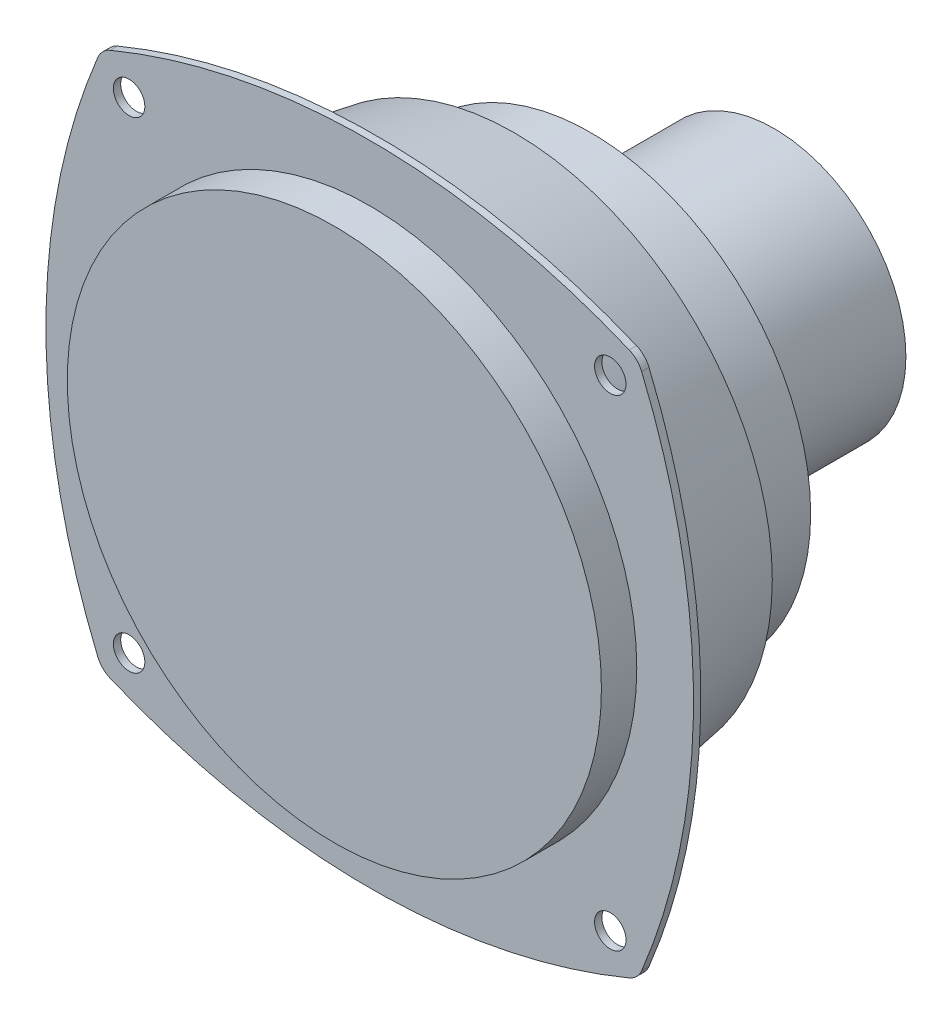
from build123d import *

# Parameters (mm, degrees)
BOSS_EXTRUDE1_DEPTH        = 1
F_4_3_4_3_DIAMETER_HOLE1_D = 4.3
SKETCH6_W                  = 28.17
SKETCH6_H                  = 2.5
BOSS_EXTRUDE2_DEPTH        = 23.53


with BuildPart() as part:
    # Sketch1 → Revolve1 (revolve)
    with BuildSketch(Plane(origin=(0, 0, 0), x_dir=(0, 0, -1), z_dir=(1, 0, 0)), mode=Mode.PRIVATE) as revolve1_sk:
        Polygon((60.11, 0), (60.11, 18), (35.01, 18), (35.01, 30.085), (24.6, 30.085), (24.6, 35.25), (5.83, 38.44), (5.83, 44.25), (4.83, 44.25), (4.83, 36.5), (0, 36.5), (0, 0), align=None)
    revolve(revolve1_sk.sketch.rotate(Axis((0, 0, 0), (0, 0, -1)), 90), axis=Axis((0, 0, 0), (0, 0, -1)))

    # Sketch2 → Boss-Extrude1 (add)
    with BuildSketch(Plane.XY.offset(-4.83)):
        with BuildLine():
            ThreePointArc((-35.456787888, 37.168658693), (0, 44.25), (35.456787888, 37.168658693))
            ThreePointArc((35.456787888, 37.168658693), (36.482290492, 36.482290492), (37.168658693, 35.456787888))
            ThreePointArc((37.168658693, 35.456787888), (44.25, 0), (37.168658693, -35.456787888))
            ThreePointArc((37.168658693, -35.456787888), (36.482290492, -36.482290492), (35.456787888, -37.168658693))
            ThreePointArc((35.456787888, -37.168658693), (0, -44.25), (-35.456787888, -37.168658693))
            ThreePointArc((-35.456787888, -37.168658693), (-36.482290492, -36.482290492), (-37.168658693, -35.456787888))
            ThreePointArc((-37.168658693, -35.456787888), (-44.25, 0), (-37.168658693, 35.456787888))
            ThreePointArc((-37.168658693, 35.456787888), (-36.482290492, 36.482290492), (-35.456787888, 37.168658693))
        make_face()
    extrude(amount=-BOSS_EXTRUDE1_DEPTH)

    # Ø4.3 (4.3) Diameter Hole1 (through all)
    with Locations(Plane.XY.offset(-4.83)):
        with Locations((-32.880465325, 32.880465325), (32.880465325, 32.880465325), (32.880465325, -32.880465325), (-32.880465325, -32.880465325)):
            Hole(F_4_3_4_3_DIAMETER_HOLE1_D / 2)

    # Sketch6 → Boss-Extrude2 (add)
    with BuildSketch(Plane(origin=(0, 0, -5.83), x_dir=(-1, 0, 0), z_dir=(0, 0, -1))):
        with Locations((0, -38.6)):
            Rectangle(SKETCH6_W, SKETCH6_H)
    extrude(amount=BOSS_EXTRUDE2_DEPTH)


solid = part.part
